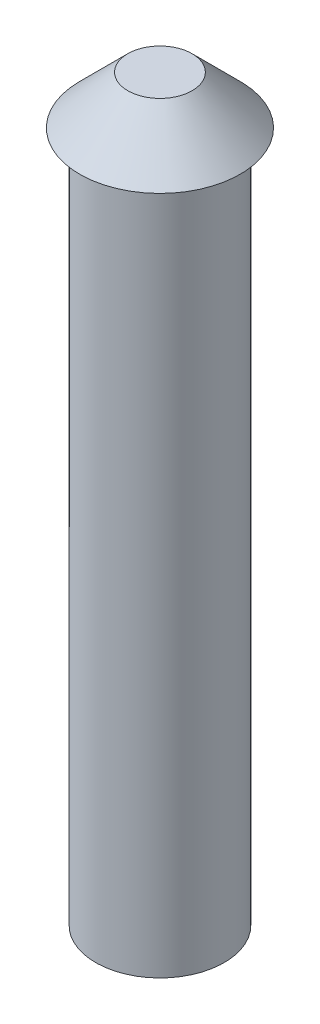
from build123d import *


with BuildPart() as part:
    # Sketch2 → Revolve1 (revolve)
    with BuildSketch(Plane.XY, mode=Mode.PRIVATE) as revolve1_sk:
        Polygon((0, 23), (0, -23), (4, -23), (4, 20), (5, 20), (2, 23), align=None)
    revolve(revolve1_sk.sketch.rotate(Axis((0, 23, 0), (0, -1, 0)), 180), axis=Axis((0, 23, 0), (0, -1, 0)))


solid = part.part
